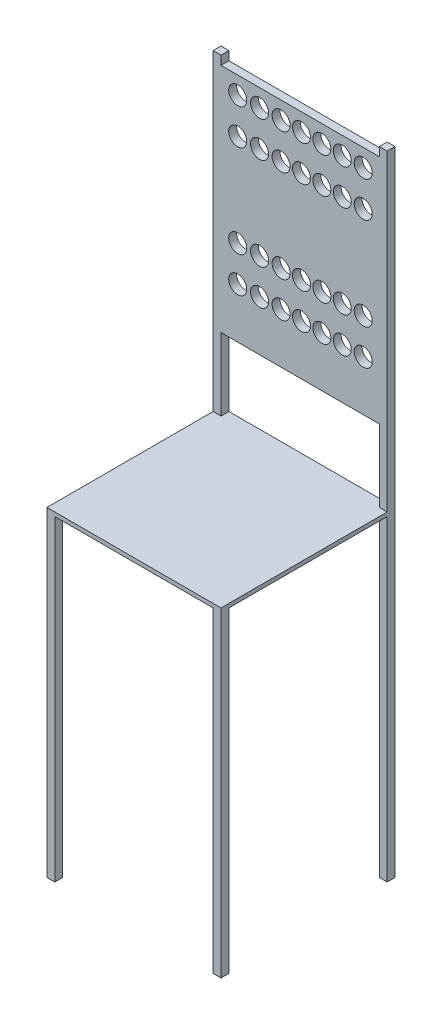
from build123d import *

# Parameters (mm, degrees)
SKETCH1_W             = 10
SKETCH1_H             = 10
BOSS_EXTRUDE1_DEPTH   = 400
BOSS_EXTRUDE1_2_DEPTH = 400
BOSS_EXTRUDE1_3_DEPTH = 400
BOSS_EXTRUDE1_4_DEPTH = 400
SKETCH2_W             = 10
SKETCH2_H             = 10
BOSS_EXTRUDE2_DEPTH   = 400
SKETCH3_W             = 220
SKETCH3_H             = 220
BOSS_EXTRUDE3_DEPTH   = 5
SKETCH4_W             = 10
SKETCH4_H             = 292.424434456
BOSS_EXTRUDE4_DEPTH   = 200
SKETCH5_R             = 11.390876375
CUT_EXTRUDE1_DEPTH    = 200


with BuildPart() as part:
    # Sketch1 → Boss-Extrude1 (new body)
    with BuildSketch(Plane(origin=(0, 0, 0), x_dir=(1, 0, 0), z_dir=(0, 1, 0))):
        with Locations((-105, 105)):
            Rectangle(SKETCH1_W, SKETCH1_H)
    extrude(amount=BOSS_EXTRUDE1_DEPTH)



with BuildPart() as body_2:
    # Sketch1 → Boss-Extrude1 2 (new body)
    with BuildSketch(Plane(origin=(0, 0, 0), x_dir=(1, 0, 0), z_dir=(0, 1, 0))):
        with Locations((105, 105)):
            Rectangle(SKETCH1_W, SKETCH1_H)
    extrude(amount=BOSS_EXTRUDE1_2_DEPTH)


with BuildPart() as body_3:
    # Sketch1 → Boss-Extrude1 3 (new body)
    with BuildSketch(Plane(origin=(0, 0, 0), x_dir=(1, 0, 0), z_dir=(0, 1, 0))):
        with Locations((105, -105)):
            Rectangle(SKETCH1_W, SKETCH1_H)
    extrude(amount=BOSS_EXTRUDE1_3_DEPTH)


with BuildPart() as body_4:
    # Sketch1 → Boss-Extrude1 4 (new body)
    with BuildSketch(Plane(origin=(0, 0, 0), x_dir=(1, 0, 0), z_dir=(0, 1, 0))):
        with Locations((-105, -105)):
            Rectangle(SKETCH1_W, SKETCH1_H)
    extrude(amount=BOSS_EXTRUDE1_4_DEPTH)


with BuildPart() as part_1:
    add(part.part)

    add(body_2.part)  # Boss-Extrude2 merges body 2
    # Sketch2 → Boss-Extrude2 (add)
    with BuildSketch(Plane(origin=(0, 400, 0), x_dir=(1, 0, 0), z_dir=(0, 1, 0))):
        with Locations((105, 105)):
            Rectangle(SKETCH2_W, SKETCH2_H)
        with Locations((-105, 105)):
            Rectangle(SKETCH2_W, SKETCH2_H)
    extrude(amount=BOSS_EXTRUDE2_DEPTH)


    add(body_3.part)  # Boss-Extrude3 merges body 3

    add(body_4.part)  # Boss-Extrude3 merges body 4
    # Sketch3 → Boss-Extrude3 (add)
    with BuildSketch(Plane(origin=(0, 400, 0), x_dir=(1, 0, 0), z_dir=(0, 1, 0))):
        Rectangle(SKETCH3_W, SKETCH3_H)
    extrude(amount=BOSS_EXTRUDE3_DEPTH)

    # Sketch4 → Boss-Extrude4 (add)
    with BuildSketch(Plane(origin=(-100, 0, 0), x_dir=(0, 0, -1), z_dir=(1, 0, 0))):
        with Locations((105, 642.632960166)):
            Rectangle(SKETCH4_W, SKETCH4_H)
    extrude(amount=BOSS_EXTRUDE4_DEPTH)

    # Sketch5 → Cut-Extrude1 (cut)
    with BuildSketch(Plane.XY.offset(-100)):
        with Locations((-78.87817112, 766.657257613)):
            Circle(SKETCH5_R)
        with Locations((-51.294465102, 766.657257613)):
            Circle(SKETCH5_R)
        with Locations((-24.073702585, 766.657257613)):
            Circle(SKETCH5_R)
        with Locations((1.695285931, 766.657257613)):
            Circle(SKETCH5_R)
        with Locations((27.464274447, 766.657257613)):
            Circle(SKETCH5_R)
        with Locations((53.233262963, 766.657257613)):
            Circle(SKETCH5_R)
        with Locations((79.728138479, 766.657257613)):
            Circle(SKETCH5_R)
        with Locations((79.728138479, 721.652263585)):
            Circle(SKETCH5_R)
        with Locations((53.233262963, 721.652263585)):
            Circle(SKETCH5_R)
        with Locations((27.464274447, 721.652263585)):
            Circle(SKETCH5_R)
        with Locations((1.695285931, 721.652263585)):
            Circle(SKETCH5_R)
        with Locations((-24.073702585, 721.652263585)):
            Circle(SKETCH5_R)
        with Locations((-51.294465102, 721.652263585)):
            Circle(SKETCH5_R)
        with Locations((-78.87817112, 721.652263585)):
            Circle(SKETCH5_R)
        with Locations((-78.87817112, 604.784456512)):
            Circle(SKETCH5_R)
        with Locations((-51.294465102, 604.784456512)):
            Circle(SKETCH5_R)
        with Locations((-24.073702585, 604.784456512)):
            Circle(SKETCH5_R)
        with Locations((1.695285931, 604.784456512)):
            Circle(SKETCH5_R)
        with Locations((27.464274447, 604.784456512)):
            Circle(SKETCH5_R)
        with Locations((53.233262963, 604.784456512)):
            Circle(SKETCH5_R)
        with Locations((79.728138479, 604.784456512)):
            Circle(SKETCH5_R)
        with Locations((79.728138479, 559.779462484)):
            Circle(SKETCH5_R)
        with Locations((53.233262963, 559.779462484)):
            Circle(SKETCH5_R)
        with Locations((27.464274447, 559.779462484)):
            Circle(SKETCH5_R)
        with Locations((1.695285931, 559.779462484)):
            Circle(SKETCH5_R)
        with Locations((-24.073702585, 559.779462484)):
            Circle(SKETCH5_R)
        with Locations((-51.294465102, 559.779462484)):
            Circle(SKETCH5_R)
        with Locations((-78.87817112, 559.779462484)):
            Circle(SKETCH5_R)
    extrude(amount=-CUT_EXTRUDE1_DEPTH, mode=Mode.SUBTRACT)


solid = part_1.part
